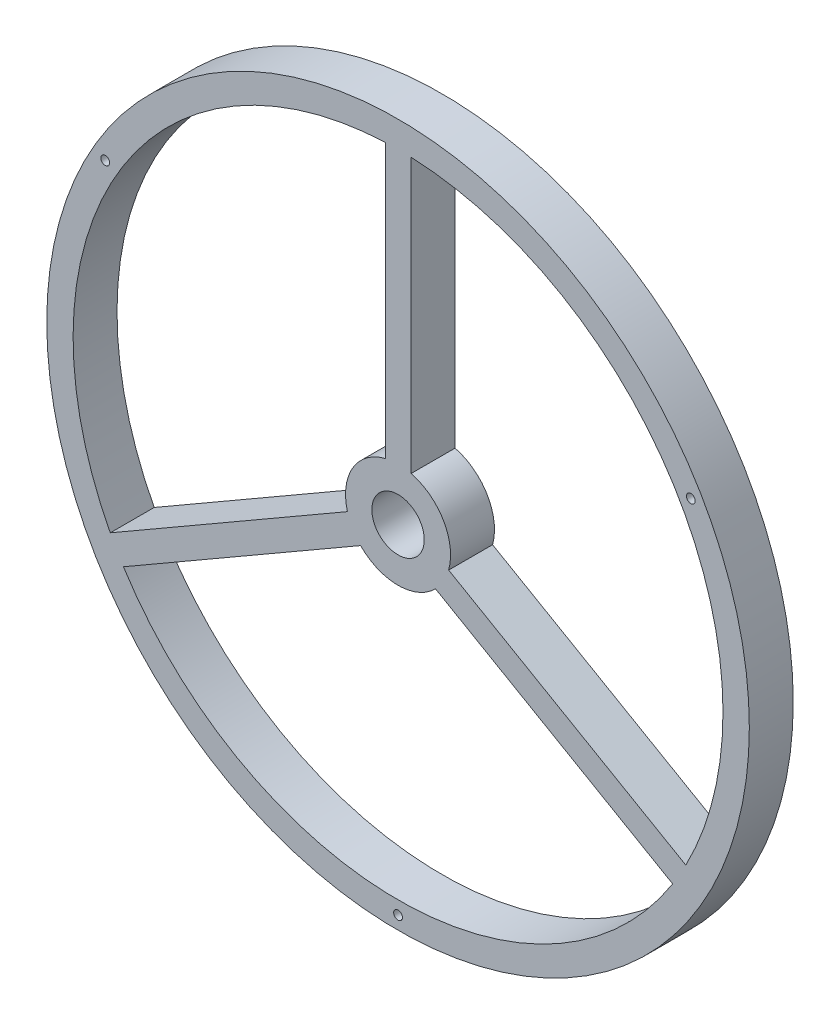
from build123d import *

# Parameters (mm, degrees)
SKETCH_1_R          = 40
SKETCH_1_R_2        = 2.980680457
EXTRUDE_2_DEPTH     = 5
SKETCH_2_R          = 0.5
CUT_EXTRUDE_1_DEPTH = 5


with BuildPart() as part:
    # 草图1 → 凸台-拉伸2 (new body)
    # profile 1 of 11: a face of its own
    with BuildSketch(Plane.XY):
        with Locations((48.296474355, 27.924907455)):
            Circle(SKETCH_1_R)
        with BuildLine():
            Line((81.82316003, 10.300317263), (81.07316003, 9.001279158))
            Line((81.07316003, 9.001279158), (80.32316003, 7.702241052))
            Line((80.32316003, 7.702241052), (79.563071613, 8.141078304))
            ThreePointArc((79.563071613, 8.141078304), (48.296474355, -9.075092545), (17.029877097, 8.141078304))
            Line((17.029877097, 8.141078304), (16.26978868, 7.702241052))
            Line((16.26978868, 7.702241052), (15.51978868, 9.001279158))
            Line((15.51978868, 9.001279158), (14.76978868, 10.300317263))
            Line((14.76978868, 10.300317263), (15.529877097, 10.739154515))
            ThreePointArc((15.529877097, 10.739154515), (16.266519565, 46.447380189), (46.84834221, 64.896557585))
            Line((46.84834221, 64.896557585), (46.84834221, 66.091480515))
            Line((46.84834221, 66.091480515), (49.787930978, 66.091480515))
            Line((49.787930978, 66.091480515), (49.787930978, 64.894835196))
            ThreePointArc((49.787930978, 64.894835196), (74.981525367, 53.555125021), (85.296474355, 27.924907455))
            ThreePointArc((85.296474355, 27.924907455), (84.222538003, 19.07516448), (81.063071613, 10.739154515))
            Line((81.063071613, 10.739154515), (81.82316003, 10.300317263))
        make_face(mode=Mode.SUBTRACT)
    # profile 2 of 11: a face of its own
    with BuildSketch(Plane.XY):
        with BuildLine():
            Line((52.565394479, 27.19229608), (54.060345519, 26.329185695))
            ThreePointArc((54.060345519, 26.329185695), (54.222704622, 27.119715831), (54.277154812, 27.924907455))
            ThreePointArc((54.277154812, 27.924907455), (53.023442951, 31.588827027), (49.787930978, 33.716633957))
            Line((49.787930978, 33.716633957), (49.787930978, 32.638782116))
            Line((49.787930978, 32.638782116), (46.84834221, 32.638782116))
            Line((46.84834221, 32.638782116), (46.84834221, 33.727618203))
            ThreePointArc((46.84834221, 33.727618203), (43.130484728, 30.938392133), (42.532603191, 26.329185695))
            Line((42.532603191, 26.329185695), (43.927397053, 27.134470306))
            Line((43.927397053, 27.134470306), (45.427397053, 24.536394095))
            Line((45.427397053, 24.536394095), (44.032603191, 23.731109483))
            ThreePointArc((44.032603191, 23.731109483), (48.296474355, 21.944226998), (52.560345519, 23.731109483))
            Line((52.560345519, 23.731109483), (51.065394479, 24.594219869))
            Line((51.065394479, 24.594219869), (52.565394479, 27.19229608))
        make_face()
        with Locations((48.296474355, 27.924907455)):
            Circle(SKETCH_1_R_2, mode=Mode.SUBTRACT)
    # profile 3 of 11: a face of its own
    with BuildSketch(Plane.XY):
        with BuildLine():
            ThreePointArc((15.529877097, 10.739154515), (16.253534415, 9.424907455), (17.029877097, 8.141078304))
            Line((17.029877097, 8.141078304), (44.032603191, 23.731109483))
            ThreePointArc((44.032603191, 23.731109483), (43.117053147, 24.934567227), (42.532603191, 26.329185695))
            Line((42.532603191, 26.329185695), (15.529877097, 10.739154515))
        make_face()
    # profile 4 of 11: a face of its own
    with BuildSketch(Plane.XY):
        with BuildLine():
            Line((16.26978868, 7.702241052), (17.029877097, 8.141078304))
            ThreePointArc((17.029877097, 8.141078304), (16.253534415, 9.424907455), (15.529877097, 10.739154515))
            Line((15.529877097, 10.739154515), (14.76978868, 10.300317263))
            Line((14.76978868, 10.300317263), (15.51978868, 9.001279158))
            Line((15.51978868, 9.001279158), (16.26978868, 7.702241052))
        make_face()
    # profile 5 of 11: a face of its own
    with BuildSketch(Plane.XY):
        with BuildLine():
            ThreePointArc((52.560345519, 23.731109483), (53.475895563, 24.934567227), (54.060345519, 26.329185695))
            Line((54.060345519, 26.329185695), (52.565394479, 27.19229608))
            Line((52.565394479, 27.19229608), (51.065394479, 24.594219869))
            Line((51.065394479, 24.594219869), (52.560345519, 23.731109483))
        make_face()
    # profile 6 of 11: a face of its own
    with BuildSketch(Plane.XY):
        with BuildLine():
            Line((49.787930978, 32.638782116), (49.787930978, 33.716633957))
            ThreePointArc((49.787930978, 33.716633957), (48.318821972, 33.90554616), (46.84834221, 33.727618203))
            Line((46.84834221, 33.727618203), (46.84834221, 32.638782116))
            Line((46.84834221, 32.638782116), (49.787930978, 32.638782116))
        make_face()
    # profile 7 of 11: a face of its own
    with BuildSketch(Plane.XY):
        with BuildLine():
            ThreePointArc((42.532603191, 26.329185695), (43.117053147, 24.934567227), (44.032603191, 23.731109483))
            Line((44.032603191, 23.731109483), (45.427397053, 24.536394095))
            Line((45.427397053, 24.536394095), (43.927397053, 27.134470306))
            Line((43.927397053, 27.134470306), (42.532603191, 26.329185695))
        make_face()
    # profile 8 of 11: a face of its own
    with BuildSketch(Plane.XY):
        with BuildLine():
            Line((49.787930978, 33.716633957), (49.787930978, 64.894835196))
            ThreePointArc((49.787930978, 64.894835196), (48.318153706, 64.924901104), (46.84834221, 64.896557585))
            Line((46.84834221, 64.896557585), (46.84834221, 33.727618203))
            ThreePointArc((46.84834221, 33.727618203), (48.318821972, 33.90554616), (49.787930978, 33.716633957))
        make_face()
    # profile 9 of 11: a face of its own
    with BuildSketch(Plane.XY):
        with BuildLine():
            ThreePointArc((46.84834221, 64.896557585), (48.318153706, 64.924901104), (49.787930978, 64.894835196))
            Line((49.787930978, 64.894835196), (49.787930978, 66.091480515))
            Line((49.787930978, 66.091480515), (46.84834221, 66.091480515))
            Line((46.84834221, 66.091480515), (46.84834221, 64.896557585))
        make_face()
    # profile 10 of 11: a face of its own
    with BuildSketch(Plane.XY):
        with BuildLine():
            Line((80.32316003, 7.702241052), (81.07316003, 9.001279158))
            Line((81.07316003, 9.001279158), (81.82316003, 10.300317263))
            Line((81.82316003, 10.300317263), (81.063071613, 10.739154515))
            ThreePointArc((81.063071613, 10.739154515), (80.339414295, 9.424907455), (79.563071613, 8.141078304))
            Line((79.563071613, 8.141078304), (80.32316003, 7.702241052))
        make_face()
    # profile 11 of 11: a face of its own
    with BuildSketch(Plane.XY):
        with BuildLine():
            ThreePointArc((79.563071613, 8.141078304), (80.339414295, 9.424907455), (81.063071613, 10.739154515))
            Line((81.063071613, 10.739154515), (54.060345519, 26.329185695))
            ThreePointArc((54.060345519, 26.329185695), (53.475895563, 24.934567227), (52.560345519, 23.731109483))
            Line((52.560345519, 23.731109483), (79.563071613, 8.141078304))
        make_face()
    extrude(amount=EXTRUDE_2_DEPTH)

    # 草图2 → 切除-拉伸1 (cut)
    with BuildSketch(Plane.XY.offset(5)):
        with Locations((14.954496309, 47.174907455)):
            Circle(SKETCH_2_R)
        with Locations((81.638452401, 47.174907455)):
            Circle(SKETCH_2_R)
        with Locations((48.296474355, -10.575092545)):
            Circle(SKETCH_2_R)
    extrude(amount=-CUT_EXTRUDE_1_DEPTH, mode=Mode.SUBTRACT)


solid = part.part
